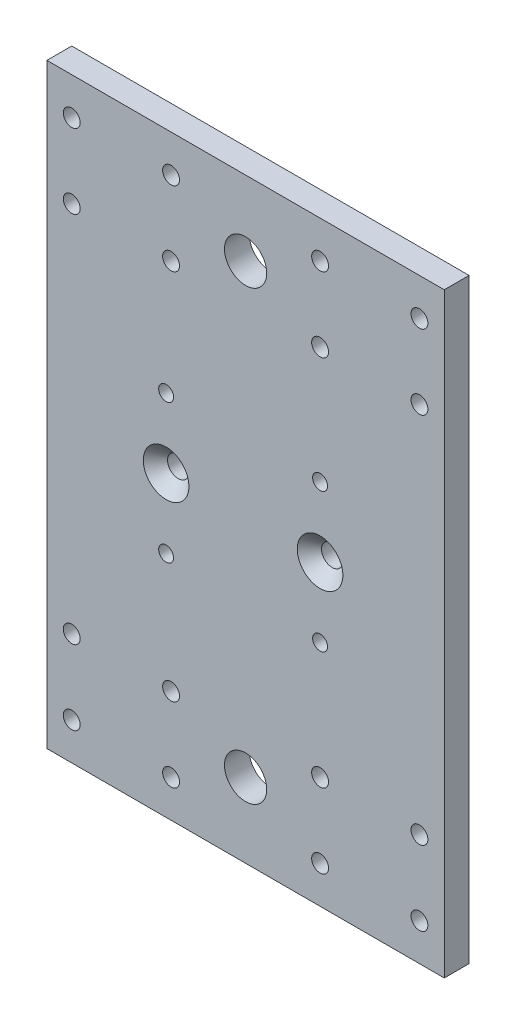
from build123d import *

# Parameters (mm, degrees)
SKIZZE1_W                                            = 80
SKIZZE1_H                                            = 120
AUFSATZ_LINEAR_AUSTRAGEN1_DEPTH                      = 5
FORMSENKUNG_F_R_M4_SENKSCHRAUBE_MIT_INNE_D           = 4.3
FORMSENKUNG_F_R_M4_SENKSCHRAUBE_MIT_INNE_DEPTH       = 11.5
FORMSENKUNG_F_R_M4_SENKSCHRAUBE_MIT_INNE_CSINK_D     = 9.18
FORMSENKUNG_F_R_M4_SENKSCHRAUBE_MIT_INNE_CSINK_ANGLE = 90
FORMSENKUNG_F_R_M4_SENKSCHRAUBE_MIT_INNE_TIP         = 1.291850331
F_3_0MM_STIFTLOCH1_D                                 = 3
F_3_0MM_STIFTLOCH1_DEPTH                             = 11.5
F_3_0MM_STIFTLOCH1_TIP                               = 0.901290929
STIRNSENKUNG_F_R_M3_FLACHKOPFSCHRAUB_2_COUNT         = 2
STIRNSENKUNG_F_R_M3_FLACHKOPFSCHRAUB_2_PITCH         = 15
STIRNSENKUNG_F_R_M3_FLACHKOPFSCHRAUB_3_COUNT         = 2
STIRNSENKUNG_F_R_M3_FLACHKOPFSCHRAUB_3_PITCH         = 25
STIRNSENKUNG_F_R_M3_FLACHKOPFSCHRAUB_4_COUNT         = 2
STIRNSENKUNG_F_R_M3_FLACHKOPFSCHRAUB_4_PITCH         = 20
STIRNSENKUNG_F_R_M3_FLACHKOPFSCHRAUB_5_COUNT         = 2
STIRNSENKUNG_F_R_M3_FLACHKOPFSCHRAUB_5_PITCH         = 90
STIRNSENKUNG_F_R_M3_FLACHKOPFSCHRAUB_6_COUNT         = 2
STIRNSENKUNG_F_R_M3_FLACHKOPFSCHRAUB_6_PITCH         = 105
STIRNSENKUNG_F_R_M3_FLACHKOPFSCHRAUB_7_COUNT         = 2
STIRNSENKUNG_F_R_M3_FLACHKOPFSCHRAUB_7_PITCH         = 106.887791632
STIRNSENKUNG_F_R_M3_FLACHKOPFSCHRAUB_8_COUNT         = 2
STIRNSENKUNG_F_R_M3_FLACHKOPFSCHRAUB_8_PITCH         = 92.195444573
M10_GEWINDEBOHRUNG1_D                                = 8.5
LINEARES_MUSTER1_COUNT                               = 2
LINEARES_MUSTER1_PITCH                               = 50


with BuildPart() as part:
    # Skizze1 → Aufsatz-Linear austragen1 (new body)
    with BuildSketch(Plane.XY.offset(10)):
        with Locations((-40, 60)):
            Rectangle(SKIZZE1_W, SKIZZE1_H)
    extrude(amount=-AUFSATZ_LINEAR_AUSTRAGEN1_DEPTH)

    # Formsenkung für M4 Senkschraube mit Innensechskant1
    with Locations(Plane.XY.offset(10)):
        with Locations((-56, 60), (-25, 60)):
            CounterSinkHole(FORMSENKUNG_F_R_M4_SENKSCHRAUBE_MIT_INNE_D / 2, FORMSENKUNG_F_R_M4_SENKSCHRAUBE_MIT_INNE_CSINK_D / 2, depth=FORMSENKUNG_F_R_M4_SENKSCHRAUBE_MIT_INNE_DEPTH, counter_sink_angle=FORMSENKUNG_F_R_M4_SENKSCHRAUBE_MIT_INNE_CSINK_ANGLE)
            with Locations((0, 0, -(FORMSENKUNG_F_R_M4_SENKSCHRAUBE_MIT_INNE_DEPTH + FORMSENKUNG_F_R_M4_SENKSCHRAUBE_MIT_INNE_TIP / 2))):  # 118° drill point
                Cone(0, FORMSENKUNG_F_R_M4_SENKSCHRAUBE_MIT_INNE_D / 2, FORMSENKUNG_F_R_M4_SENKSCHRAUBE_MIT_INNE_TIP, mode=Mode.SUBTRACT)

    # Ø3.0mm Stiftloch1
    with Locations(Plane.XY.offset(10)):
        with Locations((-56, 74), (-25, 74), (-25, 46), (-56, 46)):
            Hole(F_3_0MM_STIFTLOCH1_D / 2, depth=F_3_0MM_STIFTLOCH1_DEPTH)
            with Locations((0, 0, -(F_3_0MM_STIFTLOCH1_DEPTH + F_3_0MM_STIFTLOCH1_TIP / 2))):  # 118° drill point
                Cone(0, F_3_0MM_STIFTLOCH1_D / 2, F_3_0MM_STIFTLOCH1_TIP, mode=Mode.SUBTRACT)

    # Skizze25 → Stirnsenkung für M3 Flachkopfschraube mit Schlitz2 (revolve, cut)
    with BuildSketch(Plane(origin=(-25, 112.5, 5), x_dir=(0, 1, 0), z_dir=(1, 0, 0))):
        Polygon((0, 0), (0, 9.521463052), (1.7, 8.5), (1.7, 2.4), (3.5, 2.4), (3.5, 0), align=None)
    stirnsenkung_f_r_m3_flachkopfschraube_mi = revolve(axis=Axis((-25, 112.5, -1.35), (0, 0, 1)), mode=Mode.SUBTRACT)

    # Stirnsenkung f_r M3 Flachkopfschraub 2: Stirnsenkung für M3 Flachkopfschraube mit Schlitz2 ×2
    with Locations(*[(0, -i * STIRNSENKUNG_F_R_M3_FLACHKOPFSCHRAUB_2_PITCH, 0) for i in range(1, STIRNSENKUNG_F_R_M3_FLACHKOPFSCHRAUB_2_COUNT)]):
        add(stirnsenkung_f_r_m3_flachkopfschraube_mi, mode=Mode.SUBTRACT)

    # Stirnsenkung f_r M3 Flachkopfschraub 3: Stirnsenkung für M3 Flachkopfschraube mit Schlitz2 ×2
    with Locations(*[Vector(0.8000000000000007, -0.5999999999999991, 0) * (i * STIRNSENKUNG_F_R_M3_FLACHKOPFSCHRAUB_3_PITCH) for i in range(1, STIRNSENKUNG_F_R_M3_FLACHKOPFSCHRAUB_3_COUNT)]):
        add(stirnsenkung_f_r_m3_flachkopfschraube_mi, mode=Mode.SUBTRACT)

    # Stirnsenkung f_r M3 Flachkopfschraub 4: Stirnsenkung für M3 Flachkopfschraube mit Schlitz2 ×2
    with Locations(*[(i * STIRNSENKUNG_F_R_M3_FLACHKOPFSCHRAUB_4_PITCH, 0, 0) for i in range(1, STIRNSENKUNG_F_R_M3_FLACHKOPFSCHRAUB_4_COUNT)]):
        add(stirnsenkung_f_r_m3_flachkopfschraube_mi, mode=Mode.SUBTRACT)

    # Stirnsenkung f_r M3 Flachkopfschraub 5: Stirnsenkung für M3 Flachkopfschraube mit Schlitz2 ×2
    with Locations(*[(0, -i * STIRNSENKUNG_F_R_M3_FLACHKOPFSCHRAUB_5_PITCH, 0) for i in range(1, STIRNSENKUNG_F_R_M3_FLACHKOPFSCHRAUB_5_COUNT)]):
        add(stirnsenkung_f_r_m3_flachkopfschraube_mi, mode=Mode.SUBTRACT)

    # Stirnsenkung f_r M3 Flachkopfschraub 6: Stirnsenkung für M3 Flachkopfschraube mit Schlitz2 ×2
    with Locations(*[(0, -i * STIRNSENKUNG_F_R_M3_FLACHKOPFSCHRAUB_6_PITCH, 0) for i in range(1, STIRNSENKUNG_F_R_M3_FLACHKOPFSCHRAUB_6_COUNT)]):
        add(stirnsenkung_f_r_m3_flachkopfschraube_mi, mode=Mode.SUBTRACT)

    # Stirnsenkung f_r M3 Flachkopfschraub 7: Stirnsenkung für M3 Flachkopfschraube mit Schlitz2 ×2
    with Locations(*[Vector(0.1871121078899952, -0.9823385664224747, 0) * (i * STIRNSENKUNG_F_R_M3_FLACHKOPFSCHRAUB_7_PITCH) for i in range(1, STIRNSENKUNG_F_R_M3_FLACHKOPFSCHRAUB_7_COUNT)]):
        add(stirnsenkung_f_r_m3_flachkopfschraube_mi, mode=Mode.SUBTRACT)

    # Stirnsenkung f_r M3 Flachkopfschraub 8: Stirnsenkung für M3 Flachkopfschraube mit Schlitz2 ×2
    with Locations(*[Vector(0.2169304578186558, -0.9761870601839528, 0) * (i * STIRNSENKUNG_F_R_M3_FLACHKOPFSCHRAUB_8_PITCH) for i in range(1, STIRNSENKUNG_F_R_M3_FLACHKOPFSCHRAUB_8_COUNT)]):
        add(stirnsenkung_f_r_m3_flachkopfschraube_mi, mode=Mode.SUBTRACT)

    # M10 Gewindebohrung1 (through all)
    with Locations(Plane(origin=(0, 0, 5), x_dir=(-1, 0, 0), z_dir=(0, 0, -1))):
        with Locations((40, 15)):
            m10_gewindebohrung1 = Hole(M10_GEWINDEBOHRUNG1_D / 2)

    # Lineares Muster1: Stirnsenkung für M3 Flachkopfschraube mit Schlitz2 ×2
    with Locations(*[(-i * LINEARES_MUSTER1_PITCH, 0, 0) for i in range(1, LINEARES_MUSTER1_COUNT)]):
        add(stirnsenkung_f_r_m3_flachkopfschraube_mi, mode=Mode.SUBTRACT)

    # Lineares Muster1 copy 1 sketch → Lineares Muster1 copy 1 (revolve, cut)
    with BuildSketch(Plane(origin=(-75, 97.5, 5), x_dir=(0, 1, 0), z_dir=(1, 0, 0))):
        Polygon((0, 0), (0, 9.521463052), (1.7, 8.5), (1.7, 2.4), (3.5, 2.4), (3.5, 0), align=None)
    revolve(axis=Axis((-75, 97.5, -1.35), (0, 0, 1)), mode=Mode.SUBTRACT)

    # Lineares Muster1 copy 2 sketch → Lineares Muster1 copy 2 (revolve, cut)
    with BuildSketch(Plane(origin=(-55, 97.5, 5), x_dir=(0, 1, 0), z_dir=(1, 0, 0))):
        Polygon((0, 0), (0, 9.521463052), (1.7, 8.5), (1.7, 2.4), (3.5, 2.4), (3.5, 0), align=None)
    revolve(axis=Axis((-55, 97.5, -1.35), (0, 0, 1)), mode=Mode.SUBTRACT)

    # Lineares Muster1 copy 3 sketch → Lineares Muster1 copy 3 (revolve, cut)
    with BuildSketch(Plane(origin=(-55, 112.5, 5), x_dir=(0, 1, 0), z_dir=(1, 0, 0))):
        Polygon((0, 0), (0, 9.521463052), (1.7, 8.5), (1.7, 2.4), (3.5, 2.4), (3.5, 0), align=None)
    revolve(axis=Axis((-55, 112.5, -1.35), (0, 0, 1)), mode=Mode.SUBTRACT)

    # Lineares Muster1 copy 4 sketch → Lineares Muster1 copy 4 (revolve, cut)
    with BuildSketch(Plane(origin=(-75, 22.5, 5), x_dir=(0, 1, 0), z_dir=(1, 0, 0))):
        Polygon((0, 0), (0, 9.521463052), (1.7, 8.5), (1.7, 2.4), (3.5, 2.4), (3.5, 0), align=None)
    revolve(axis=Axis((-75, 22.5, -1.35), (0, 0, 1)), mode=Mode.SUBTRACT)

    # Lineares Muster1 copy 5 sketch → Lineares Muster1 copy 5 (revolve, cut)
    with BuildSketch(Plane(origin=(-75, 7.5, 5), x_dir=(0, 1, 0), z_dir=(1, 0, 0))):
        Polygon((0, 0), (0, 9.521463052), (1.7, 8.5), (1.7, 2.4), (3.5, 2.4), (3.5, 0), align=None)
    revolve(axis=Axis((-75, 7.5, -1.35), (0, 0, 1)), mode=Mode.SUBTRACT)

    # Lineares Muster1 copy 6 sketch → Lineares Muster1 copy 6 (revolve, cut)
    with BuildSketch(Plane(origin=(-55, 7.5, 5), x_dir=(0, 1, 0), z_dir=(1, 0, 0))):
        Polygon((0, 0), (0, 9.521463052), (1.7, 8.5), (1.7, 2.4), (3.5, 2.4), (3.5, 0), align=None)
    revolve(axis=Axis((-55, 7.5, -1.35), (0, 0, 1)), mode=Mode.SUBTRACT)

    # Lineares Muster1 copy 7 sketch → Lineares Muster1 copy 7 (revolve, cut)
    with BuildSketch(Plane(origin=(-55, 22.5, 5), x_dir=(0, 1, 0), z_dir=(1, 0, 0))):
        Polygon((0, 0), (0, 9.521463052), (1.7, 8.5), (1.7, 2.4), (3.5, 2.4), (3.5, 0), align=None)
    revolve(axis=Axis((-55, 22.5, -1.35), (0, 0, 1)), mode=Mode.SUBTRACT)

    # Spiegeln1: M10 Gewindebohrung1 across plane
    add(m10_gewindebohrung1.mirror(Plane(origin=(0, 60, 0), x_dir=(0, 0, 1), z_dir=(0, -1, 0))), mode=Mode.SUBTRACT)


solid = part.part
